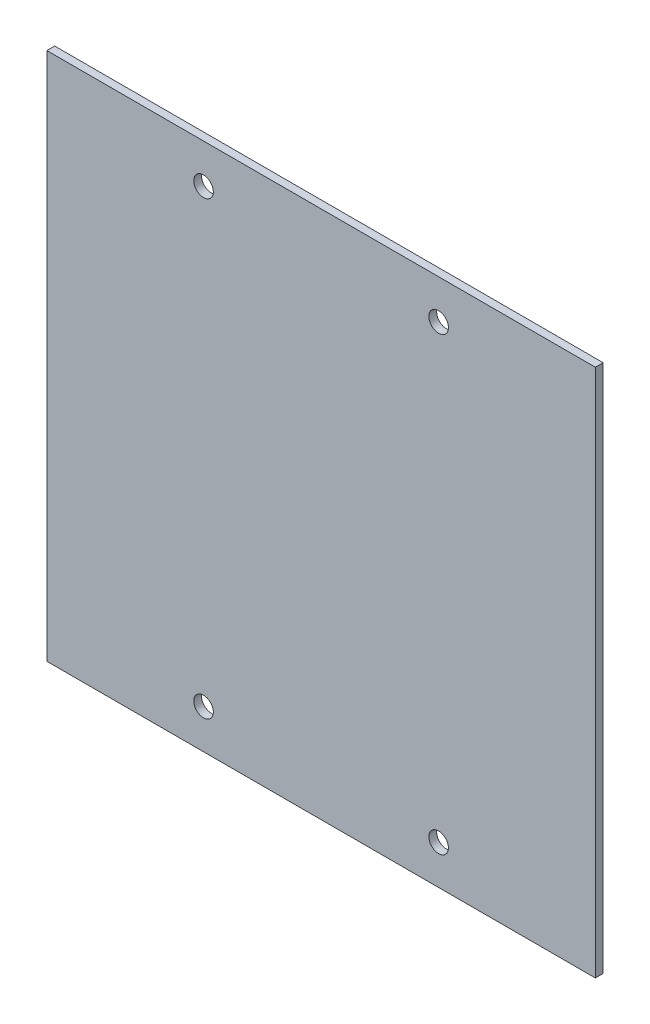
from build123d import *

# Parameters (mm, degrees)
IZIM1_W                     = 140
IZIM1_H                     = 135
IZIM1_R                     = 2.5
Y_KSEKLIK_EKSTR_ZYON1_DEPTH = 2


with BuildPart() as part:
    # Çizim1 → Yükseklik-Ekstrüzyon1 (new body)
    with BuildSketch(Plane.XY):
        with Locations((70, 67.5)):
            Rectangle(IZIM1_W, IZIM1_H)
        with Locations((40, 125)):
            Circle(IZIM1_R, mode=Mode.SUBTRACT)
        with Locations((100, 125)):
            Circle(IZIM1_R, mode=Mode.SUBTRACT)
        with Locations((40, 10)):
            Circle(IZIM1_R, mode=Mode.SUBTRACT)
        with Locations((100, 10)):
            Circle(IZIM1_R, mode=Mode.SUBTRACT)
    extrude(amount=Y_KSEKLIK_EKSTR_ZYON1_DEPTH)


solid = part.part
